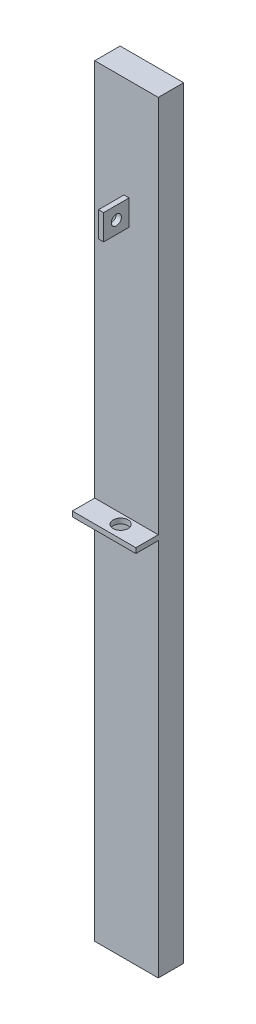
from build123d import *

# Parameters (mm, degrees)
SKETCH1_W           = 25
SKETCH1_H           = 300
SKETCH1_W_2         = 22
SKETCH1_H_2         = 297
BOSS_EXTRUDE1_DEPTH = 10
SKETCH3_W           = 22
SKETCH3_H           = 297
BOSS_EXTRUDE2_DEPTH = 1.5
BOSS_EXTRUDE3_DEPTH = 25
SKETCH7_R           = 2.959313076
CUT_EXTRUDE1_DEPTH  = 2
SKETCH9_W           = 2
SKETCH9_H           = 10
BOSS_EXTRUDE4_DEPTH = 10
SKETCH10_R          = 2
CUT_EXTRUDE2_DEPTH  = 15
SKETCH11_W          = 22
SKETCH11_H          = 297
CUT_EXTRUDE7_DEPTH  = 8


with BuildPart() as part:
    # Sketch1 → Boss-Extrude1 (new body)
    with BuildSketch(Plane.XY):
        with Locations((-21.911764706, -122.5)):
            Rectangle(SKETCH1_W, SKETCH1_H)
        with Locations((-21.911764706, -122.5)):
            Rectangle(SKETCH1_W_2, SKETCH1_H_2, mode=Mode.SUBTRACT)
    extrude(amount=BOSS_EXTRUDE1_DEPTH)

    # Sketch3 → Boss-Extrude2 (add)
    with BuildSketch(Plane.XY.offset(10)):
        with Locations((-21.911764706, -122.5)):
            Rectangle(SKETCH3_W, SKETCH3_H)
    extrude(amount=-BOSS_EXTRUDE2_DEPTH)

    # Sketch6 → Boss-Extrude3 (add)
    with BuildSketch(Plane.ZY.offset(34.411764706)):
        Polygon((10, -121.5), (18.820577113, -121.5), (18.820577113, -123.5), (10, -123.5), (10, -272.5), (0, -272.5), (0, 27.5), (10, 27.5), align=None)
    extrude(amount=-BOSS_EXTRUDE3_DEPTH)

    # Sketch7 → Cut-Extrude1 (cut)
    with BuildSketch(Plane.XZ.offset(123.5)):
        with Locations(Location((-20.411764706, 13.820577113, 0), (0, 0, 270))):
            Circle(SKETCH7_R)
    extrude(amount=-CUT_EXTRUDE1_DEPTH, mode=Mode.SUBTRACT)

    # Sketch9 → Boss-Extrude4 (add)
    with BuildSketch(Plane.XY.offset(10)):
        with Locations((-21.911764706, -17.5)):
            Rectangle(SKETCH9_W, SKETCH9_H)
    extrude(amount=BOSS_EXTRUDE4_DEPTH)

    # Sketch10 → Cut-Extrude2 (cut)
    with BuildSketch(Plane.ZY.offset(34.411764706)):
        with Locations((15, -17.5)):
            Circle(SKETCH10_R)
    extrude(amount=-CUT_EXTRUDE2_DEPTH, mode=Mode.SUBTRACT)

    # Sketch11 → Cut-Extrude7 (cut)
    with BuildSketch(Plane(origin=(0, 0, 0), x_dir=(-1, 0, 0), z_dir=(0, 0, -1))):
        with Locations((21.911764706, -122.5)):
            Rectangle(SKETCH11_W, SKETCH11_H)
    extrude(amount=-CUT_EXTRUDE7_DEPTH, mode=Mode.SUBTRACT)


solid = part.part
